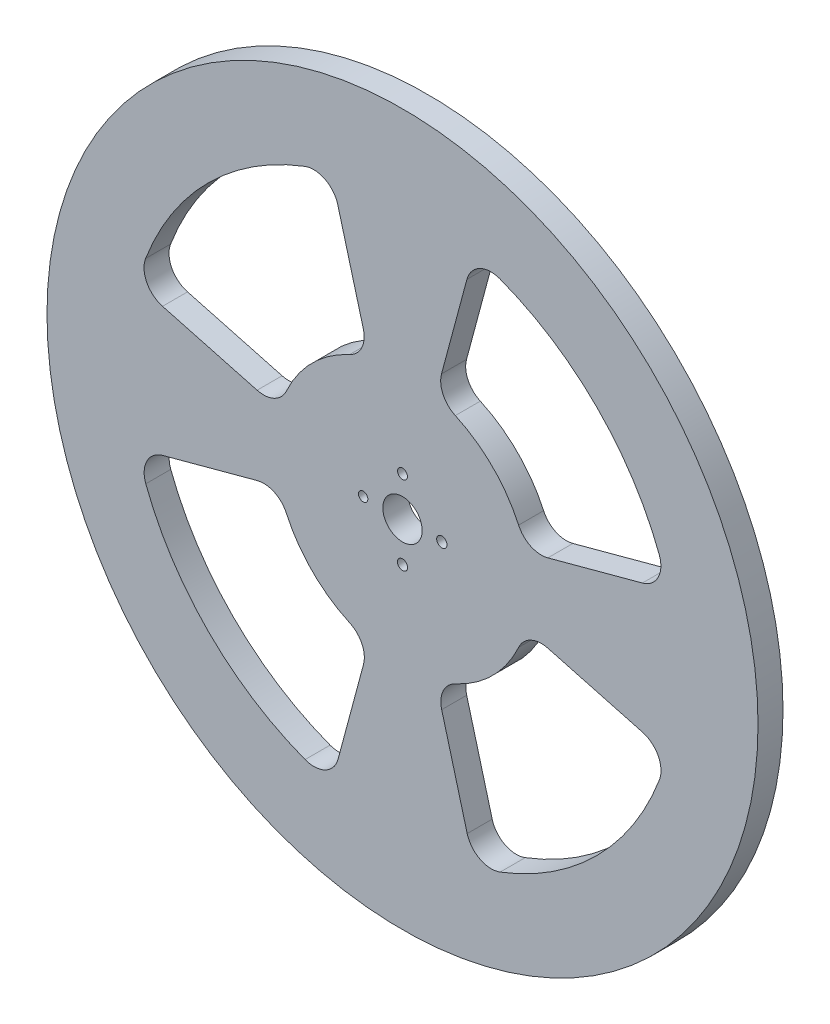
from build123d import *

# Parameters (mm, degrees)
SKETCH1_R           = 72.270783293
SKETCH1_R_2         = 1.029023024
SKETCH1_R_3         = 0.951973647
SKETCH1_R_4         = 4
SKETCH1_R_5         = 1.050065139
SKETCH1_R_6         = 1.001019393
BOSS_EXTRUDE1_DEPTH = 5.08


with BuildPart() as part:
    # Sketch1 → Boss-Extrude1 (new body)
    with BuildSketch(Plane.XY):
        Circle(SKETCH1_R)
        with BuildLine():
            ThreePointArc((-10.737087643, -23.615107406), (-8.245531622, -26.07156763), (-7.93335155, -29.556476789))
            Line((-7.93335155, -29.556476789), (-13.09319037, -48.779960759))
            ThreePointArc((-13.09319037, -48.779960759), (-15.685085812, -51.985178513), (-19.800843937, -52.212945683))
            ThreePointArc((-19.800843937, -52.212945683), (-39.462982159, -39.508709884), (-52.189979739, -19.86129735))
            ThreePointArc((-52.189979739, -19.86129735), (-51.966979092, -15.745278212), (-48.764765106, -13.149672615))
            Line((-48.764765106, -13.149672615), (-29.547269525, -7.967574951))
            ThreePointArc((-29.547269525, -7.967574951), (-26.062001174, -8.275719015), (-23.60265718, -10.764428592))
            ThreePointArc((-23.60265718, -10.764428592), (-18.33274407, -18.353987134), (-10.737087643, -23.615107406))
        make_face(mode=Mode.SUBTRACT)
        with BuildLine():
            ThreePointArc((23.615107406, -10.737087643), (26.07156763, -8.245531622), (29.556476789, -7.93335155))
            Line((29.556476789, -7.93335155), (48.779960759, -13.09319037))
            ThreePointArc((48.779960759, -13.09319037), (51.985178513, -15.685085812), (52.212945683, -19.800843937))
            ThreePointArc((52.212945683, -19.800843937), (39.508709884, -39.462982159), (19.86129735, -52.189979739))
            ThreePointArc((19.86129735, -52.189979739), (15.745278212, -51.966979092), (13.149672615, -48.764765106))
            Line((13.149672615, -48.764765106), (7.967574951, -29.547269525))
            ThreePointArc((7.967574951, -29.547269525), (8.275719015, -26.062001174), (10.764428592, -23.60265718))
            ThreePointArc((10.764428592, -23.60265718), (18.353987134, -18.33274407), (23.615107406, -10.737087643))
        make_face(mode=Mode.SUBTRACT)
        with Locations((0, -8)):
            Circle(SKETCH1_R_2, mode=Mode.SUBTRACT)
        with Locations((-8, 0)):
            Circle(SKETCH1_R_3, mode=Mode.SUBTRACT)
        with BuildLine():
            ThreePointArc((-23.615107406, 10.737087643), (-26.07156763, 8.245531622), (-29.556476789, 7.93335155))
            Line((-29.556476789, 7.93335155), (-48.779960759, 13.09319037))
            ThreePointArc((-48.779960759, 13.09319037), (-51.985178513, 15.685085812), (-52.212945683, 19.800843937))
            ThreePointArc((-52.212945683, 19.800843937), (-39.508709884, 39.462982159), (-19.86129735, 52.189979739))
            ThreePointArc((-19.86129735, 52.189979739), (-15.745278212, 51.966979092), (-13.149672615, 48.764765106))
            Line((-13.149672615, 48.764765106), (-7.967574951, 29.547269525))
            ThreePointArc((-7.967574951, 29.547269525), (-8.275719015, 26.062001174), (-10.764428592, 23.60265718))
            ThreePointArc((-10.764428592, 23.60265718), (-18.353987134, 18.33274407), (-23.615107406, 10.737087643))
        make_face(mode=Mode.SUBTRACT)
        Circle(SKETCH1_R_4, mode=Mode.SUBTRACT)
        with Locations((8, 0)):
            Circle(SKETCH1_R_5, mode=Mode.SUBTRACT)
        with Locations((0, 8)):
            Circle(SKETCH1_R_6, mode=Mode.SUBTRACT)
        with BuildLine():
            ThreePointArc((10.737087643, 23.615107406), (8.245531622, 26.07156763), (7.93335155, 29.556476789))
            Line((7.93335155, 29.556476789), (13.09319037, 48.779960759))
            ThreePointArc((13.09319037, 48.779960759), (15.685085812, 51.985178513), (19.800843937, 52.212945683))
            ThreePointArc((19.800843937, 52.212945683), (39.462982159, 39.508709884), (52.189979739, 19.86129735))
            ThreePointArc((52.189979739, 19.86129735), (51.966979092, 15.745278212), (48.764765106, 13.149672615))
            Line((48.764765106, 13.149672615), (29.547269525, 7.967574951))
            ThreePointArc((29.547269525, 7.967574951), (26.062001174, 8.275719015), (23.60265718, 10.764428592))
            ThreePointArc((23.60265718, 10.764428592), (18.33274407, 18.353987134), (10.737087643, 23.615107406))
        make_face(mode=Mode.SUBTRACT)
    extrude(amount=BOSS_EXTRUDE1_DEPTH)


solid = part.part
